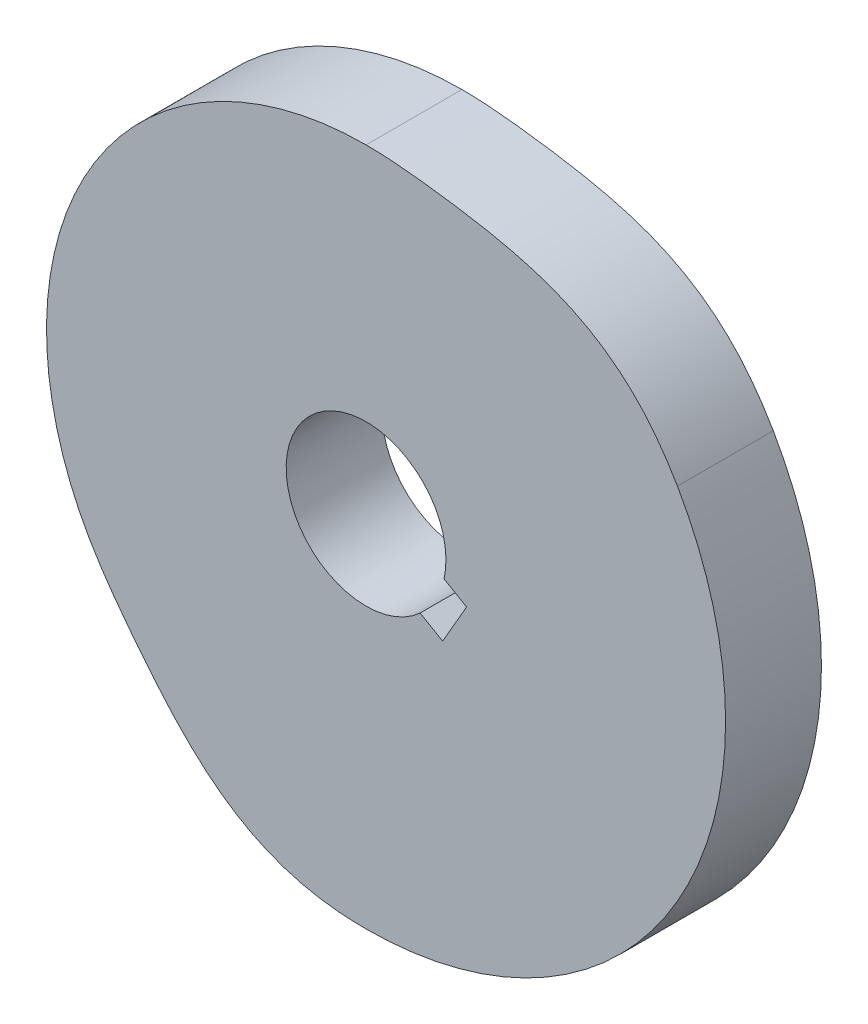
from build123d import *

# Parameters (mm, degrees)
EXTRUDE_1_DEPTH          = 12
CUT_EXTRUDE_1_DEPTH      = 12
CUT_EXTRUDE_1_DEPTH_BACK = 12


with BuildPart() as part:
    # 草图1 → 凸台-拉伸1 (new body)
    with BuildSketch(Plane.XY):
        with BuildLine():
            ThreePointArc((38.97114317, 22.5), (38.97114317, -22.5), (0, -45))
            add(Edge.make_bspline(
                [(0, -45), (-0.523588562, -45.000001824), (-1.308996546, -44.986287154), (-2.355040538, -44.936973624), (-3.138561651, -44.883613379), (-3.920631292, -44.813054932), (-4.70074178, -44.724529495), (-5.478335846, -44.617332694), (-6.252812136, -44.490834911), (-7.02353199, -44.344490532), (-7.789826844, -44.177846129), (-8.551006285, -43.990547434), (-9.306366601, -43.782344994), (-10.055199679, -43.553098452), (-10.796802122, -43.302779375), (-11.530484409, -43.031472601), (-12.255579979, -42.73937609), (-12.971454051, -42.426799279), (-13.677512056, -42.09415998), (-14.37320753, -41.741979863), (-15.05804933, -41.370878602), (-15.731608057, -40.981566772), (-16.393521567, -40.574837604), (-17.043499489, -40.151557733), (-17.681326658, -39.712657057), (-18.306865404, -39.259117879), (-18.920056659, -38.791963465), (-19.520919847, -38.312246209), (-20.109551561, -37.821035543), (-20.686123026, -37.31940579), (-21.250876386, -36.808424103), (-21.804119858, -36.289138682), (-22.346221822, -35.762567407), (-22.877603916, -35.229687052), (-23.398733251, -34.691423221), (-23.910113836, -34.148641142), (-24.412277346, -33.602137436), (-24.905773374, -33.052632959), (-25.391159289, -32.500766815), (-25.868989871, -31.947091613), (-26.339806873, -31.392070001), (-26.804128666, -30.836072544), (-27.262440122, -30.279376925), (-27.715182905, -29.7221685), (-28.162746317, -29.164542162), (-28.605458836, -28.606505484), (-29.043580492, -28.047983083), (-29.477296206, -27.488822134), (-29.90671018, -26.928798938), (-30.331841461, -26.367626442), (-30.75262073, -25.804962595), (-31.168888381, -25.240419403), (-31.580393929, -24.673572552), (-31.986796771, -24.103971433), (-32.387668279, -23.531149436), (-32.782495247, -22.954634315), (-33.170684562, -22.373958572), (-33.551569347, -21.788669334), (-34.048685337, -21.001581207), (-34.408299842, -20.403074718), (-34.641016151, -20)],
                knots=[0, 0, 0, 0, 0.03496569, 0.052447761, 0.069928514, 0.087407152, 0.104882797, 0.122354544, 0.139821494, 0.157282786, 0.174737606, 0.19218518, 0.209624761, 0.227055593, 0.244476873, 0.261887701, 0.279287021, 0.296673569, 0.314045814, 0.331401914, 0.348739666, 0.366056487, 0.383349391, 0.400614991, 0.41784952, 0.435048865, 0.452208618, 0.469324147, 0.486390681, 0.50340341, 0.520357584, 0.537248637, 0.554072295, 0.570824701, 0.587502516, 0.604103031, 0.620624249, 0.637064964, 0.653424809, 0.669704291, 0.685904798, 0.702028578, 0.718078697, 0.734058971, 0.749973875, 0.765828434, 0.781628096, 0.797378593, 0.813085806, 0.828755612, 0.844393755, 0.860005715, 0.875596595, 0.891171031, 0.906733116, 0.922286353, 0.937833634, 0.953377231, 0.968918825, 1, 1, 1, 1], degree=3))
            ThreePointArc((-34.641016151, -20), (-34.641016151, 20), (0, 40))
            add(Edge.make_bspline(
                [(0, 40), (0.4654311, 39.999999123), (1.163560176, 39.987817071), (2.093756484, 39.950846058), (2.791074225, 39.913634778), (3.488048828, 39.867790841), (4.184739053, 39.814118217), (4.881253208, 39.753364306), (5.577743667, 39.68620968), (6.274400215, 39.613258847), (6.971442786, 39.535032082), (7.669113606, 39.45195847), (8.367668884, 39.364370228), (9.067370185, 39.272498416), (9.768475628, 39.176470065), (10.471231044, 39.07630678), (11.175861244, 38.971924832), (11.882561524, 38.863136716), (12.591489567, 38.749654177), (13.302757843, 38.631092623), (14.016426662, 38.506976884), (14.732497978, 38.376748205), (15.45091006, 38.239772383), (16.171533117, 38.095348923), (16.894165968, 37.942721064), (17.618533816, 37.78108656), (18.344287177, 37.609609022), (19.071001996, 37.427429695), (19.798180969, 37.23367948), (20.525256051, 37.027491046), (21.251592153, 36.808010854), (21.976491955, 36.574410941), (22.699201797, 36.325900283), (23.41891857, 36.061735598), (24.134797494, 35.78123144), (24.845960711, 35.483769443), (25.551506534, 35.168806587), (26.250519254, 34.835882393), (26.942079336, 34.484624936), (27.625273883, 34.114755605), (28.299207181, 33.726092553), (28.963011201, 33.318552786), (29.615855866, 32.892152891), (30.256958951, 32.447008371), (30.885595446, 31.983331645), (31.50110623, 31.501428717), (32.102905932, 31.001694605), (32.690489833, 30.484607589), (33.263439702, 29.95072239), (33.821428462, 29.400662388), (34.36422361, 28.835111002), (34.891689323, 28.254802394), (35.403787201, 27.66051161), (35.900575639, 27.05304436), (36.382207825, 26.433226546), (36.848928347, 25.801893764), (37.301068575, 25.15988081), (37.739040459, 24.508011745), (38.304769224, 23.62676784), (38.709350469, 22.953441907), (38.97114317, 22.5)],
                knots=[0, 0, 0, 0, 0.031081175, 0.046622769, 0.062166366, 0.077713647, 0.093266884, 0.108828969, 0.124403405, 0.139994285, 0.155606245, 0.171244388, 0.186914194, 0.202621407, 0.218371904, 0.234171566, 0.250026125, 0.265941029, 0.281921303, 0.297971422, 0.314095202, 0.330295709, 0.346575191, 0.362935036, 0.379375751, 0.395896969, 0.412497484, 0.429175299, 0.445927705, 0.462751363, 0.479642416, 0.49659659, 0.513609319, 0.530675853, 0.547791382, 0.564951135, 0.58215048, 0.599385009, 0.616650609, 0.633943513, 0.651260334, 0.668598086, 0.685954186, 0.703326431, 0.720712979, 0.738112299, 0.755523127, 0.772944407, 0.790375239, 0.80781482, 0.825262394, 0.842717214, 0.860178506, 0.877645456, 0.895117203, 0.912592848, 0.930071486, 0.947552239, 0.96503431, 1, 1, 1, 1], degree=3))
        make_face()
    extrude(amount=EXTRUDE_1_DEPTH)

    # 草图2 → 切除-拉伸1 (cut, two sides: drawn at the far end of the back side and taken through both)
    with BuildSketch(Plane.XY.offset(-CUT_EXTRUDE_1_DEPTH_BACK)):
        with BuildLine():
            Line((9.761355821, -2.171619796), (12.585125127, -3.801923765))
            Line((12.585125127, -3.801923765), (9.585125127, -8.998076188))
            Line((9.585125127, -8.998076188), (6.761355821, -7.367772218))
            ThreePointArc((6.761355821, -7.367772218), (-8.660254038, 5), (9.761355821, -2.171619796))
        make_face()
    extrude(amount=CUT_EXTRUDE_1_DEPTH + CUT_EXTRUDE_1_DEPTH_BACK, mode=Mode.SUBTRACT)


solid = part.part
